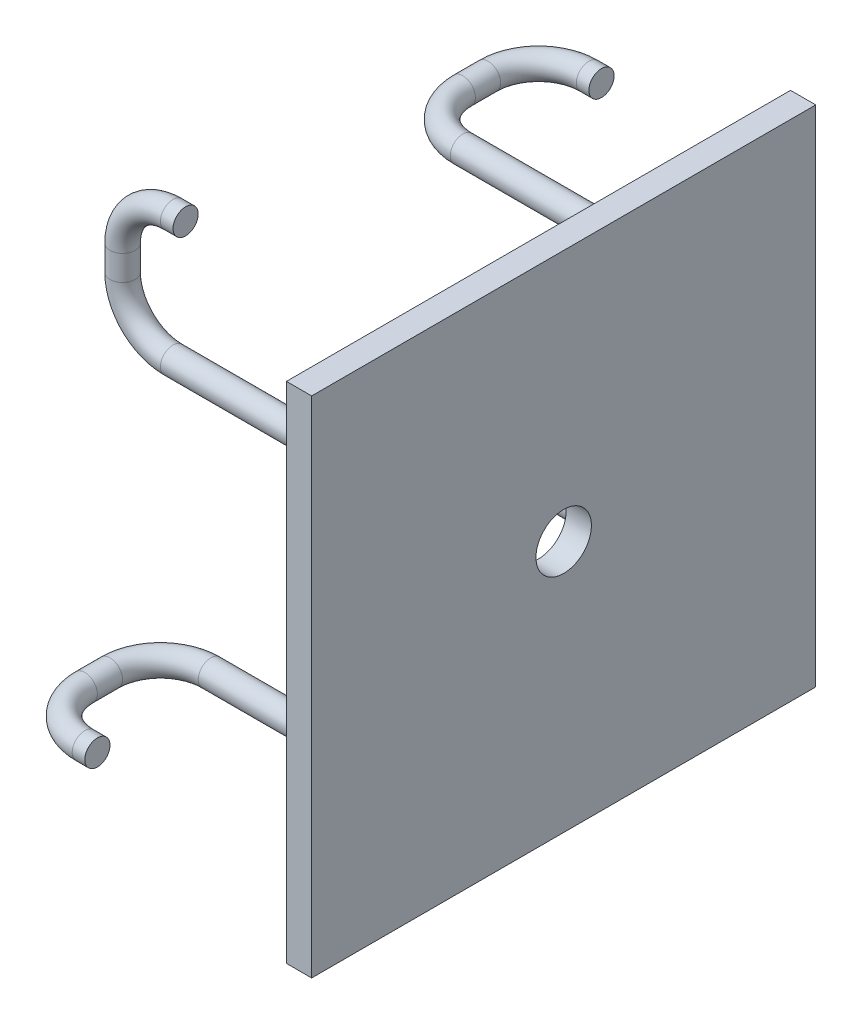
from build123d import *

# Parameters (mm, degrees)
SKETCH1_W           = 200
SKETCH1_H           = 200
SKETCH1_R           = 11
BOSS_EXTRUDE1_DEPTH = 10
SKETCH3_R           = 5
CIRPATTERN1_COUNT   = 4


with BuildPart() as part:
    # Sketch1 → Boss-Extrude1 (new body)
    with BuildSketch(Plane(origin=(-450, 0, 0), x_dir=(0, 0, -1), z_dir=(1, 0, 0))):
        with Locations((112, 23310.188643653)):
            Rectangle(SKETCH1_W, SKETCH1_H)
        with Locations((112, 23310.188643653)):
            Circle(SKETCH1_R, mode=Mode.SUBTRACT)
    extrude(amount=-BOSS_EXTRUDE1_DEPTH)

    # Sweep1: sweep along a curve in space
    with BuildLine() as sweep1_path:
        Line((-460, 23260.188643653, -177), (-540, 23260.188643653, -177))
        ThreePointArc((-540, 23260.188643653, -177), (-554.142135624, 23254.330779277, -177), (-560, 23240.188643653, -177))
        Line((-560, 23240.188643653, -177), (-560, 23230.188643653, -177))
        ThreePointArc((-560, 23230.188643653, -177), (-554.142135624, 23216.046508029, -177), (-540, 23210.188643653, -177))
        Line((-540, 23210.188643653, -177), (-535, 23210.188643653, -177))
    # Sketch3 → Sweep1 (sweep)
    with BuildSketch(Plane.ZY.offset(460)):
        with Locations((-177, 23260.188643653)):
            Circle(SKETCH3_R)
    sweep1 = sweep(path=sweep1_path.line)

    # CirPattern1: Sweep1 ×4 about axis
    cirpattern1_axis = Axis((0, 23310.188643653, -112), (1, 0, 0))
    for i in range(1, CIRPATTERN1_COUNT):
        add(sweep1.rotate(cirpattern1_axis, i * 360 / CIRPATTERN1_COUNT))


solid = part.part
